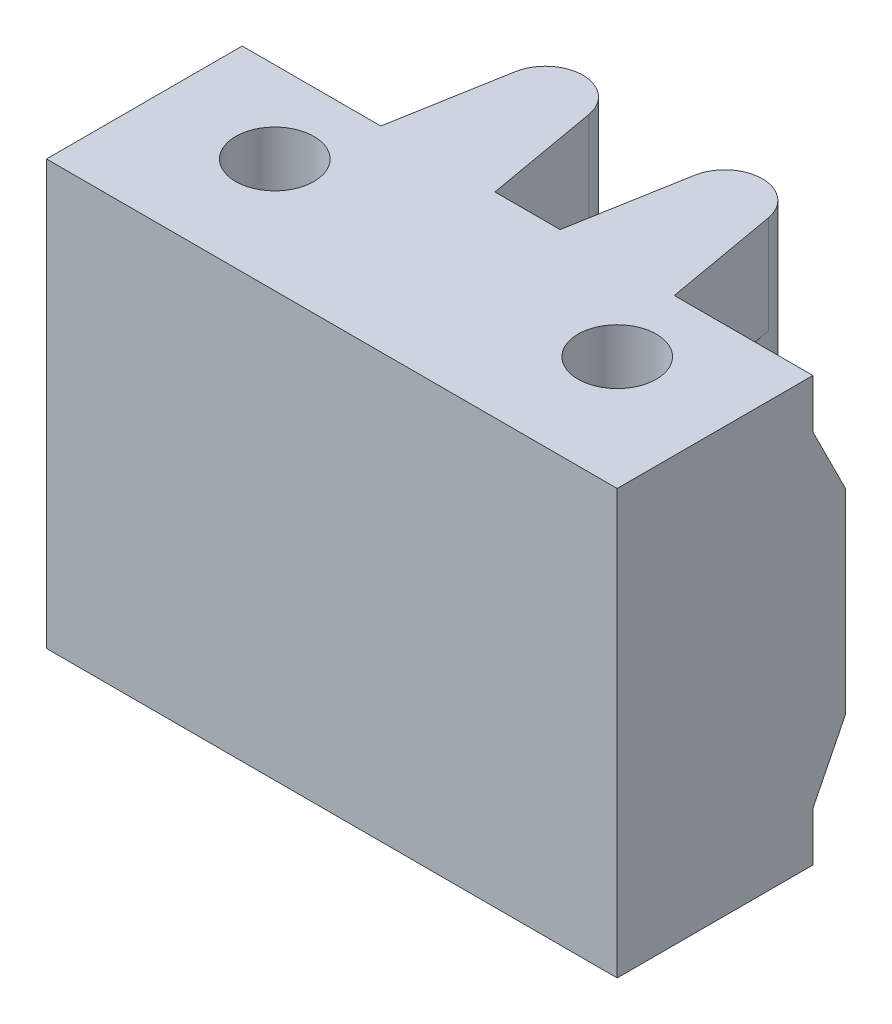
from build123d import *

# Parameters (mm, degrees)
SKETCH_1_W          = 17.5
SKETCH_1_H          = 13
EXTRUDE_1_DEPTH     = 6
EXTRUDE_2_DEPTH     = 3
EXTRUDE_3_REACH     = 23.03
SKETCH_3_R          = 1.150331691
EXTRUDE_4_DEPTH     = 3
SKETCH_6_R          = 1.2
CUT_EXTRUDE_1_DEPTH = 5


with BuildPart() as part:
    # 草圖1 → 填料-伸長1 (new body)
    with BuildSketch(Plane.XY):
        with Locations((-8.75, 6.5)):
            Rectangle(SKETCH_1_W, SKETCH_1_H)
    extrude(amount=EXTRUDE_1_DEPTH)

    # 草圖2 → 填料-伸長2 (add)
    with BuildSketch(Plane(origin=(0, 13, 0), x_dir=(1, 0, 0), z_dir=(0, 1, 0))):
        with BuildLine():
            Line((-12.632855568, 3.5), (-13.25, 0))
            Line((-13.25, 0), (-9.75, 0))
            Line((-9.75, 0), (-10.367144432, 3.5))
            ThreePointArc((-10.367144432, 3.5), (-11.5, 4.450578689), (-12.632855568, 3.5))
        make_face()
        with BuildLine():
            Line((-4.867144432, 3.5), (-4.25, 0))
            Line((-4.25, 0), (-7.75, 0))
            Line((-7.75, 0), (-7.132855568, 3.5))
            ThreePointArc((-7.132855568, 3.5), (-6, 4.450578689), (-4.867144432, 3.5))
        make_face()
    extrude_2 = extrude(amount=-EXTRUDE_2_DEPTH)

    # 鏡射1: 填料-伸長2 across plane
    add(extrude_2.mirror(Plane.ZX.offset(6.5)))

    # 草圖3 → 填料-伸長3 (add, up to next)
    with BuildSketch(Plane(origin=(0, 3, 0), x_dir=(1, 0, 0), z_dir=(0, 1, 0)), mode=Mode.PRIVATE) as extrude_3_sk1:
        with Locations((-11.5, 3.300246998)):
            Circle(SKETCH_3_R)
    extrude_3_tool1 = extrude(extrude_3_sk1.sketch, amount=EXTRUDE_3_REACH, mode=Mode.PRIVATE) - part.part
    # 草圖3 → 填料-伸長3 (add, up to next)
    with BuildSketch(Plane(origin=(0, 3, 0), x_dir=(1, 0, 0), z_dir=(0, 1, 0)), mode=Mode.PRIVATE) as extrude_3_sk2:
        with Locations((-6, 3.300246998)):
            Circle(SKETCH_3_R)
    extrude_3_tool2 = extrude(extrude_3_sk2.sketch, amount=EXTRUDE_3_REACH, mode=Mode.PRIVATE) - part.part
    add(extrude_3_tool1.solids().sort_by_distance((-11.5, 3, -3.300247))[0])
    add(extrude_3_tool2.solids().sort_by_distance((-6, 3, -3.300247))[0])

    # 草圖4 → 填料-伸長4 (add)
    with BuildSketch(Plane.ZY.offset(17.5)):
        Polygon((0, 11.5), (0, 1.5), (-1, 3.5), (-1, 9.5), align=None)
    extrude_4 = extrude(amount=-EXTRUDE_4_DEPTH)

    # 鏡射2: 填料-伸長4 across plane
    add(extrude_4.mirror(Plane(origin=(-8.75, 0, 0), x_dir=(0, 0, 1), z_dir=(1, 0, 0))))

    # 草圖6 → 除料-伸長1 (cut)
    with BuildSketch(Plane(origin=(0, 13, 0), x_dir=(1, 0, 0), z_dir=(0, 1, 0))):
        with Locations((-14, -2.5)):
            Circle(SKETCH_6_R)
        with Locations((-3.5, -2.5)):
            Circle(SKETCH_6_R)
    cut_extrude_1 = extrude(amount=-CUT_EXTRUDE_1_DEPTH, mode=Mode.SUBTRACT)

    # 鏡射3: 除料-伸長1 across plane
    add(cut_extrude_1.mirror(Plane.ZX.offset(6.5)), mode=Mode.SUBTRACT)


solid = part.part
